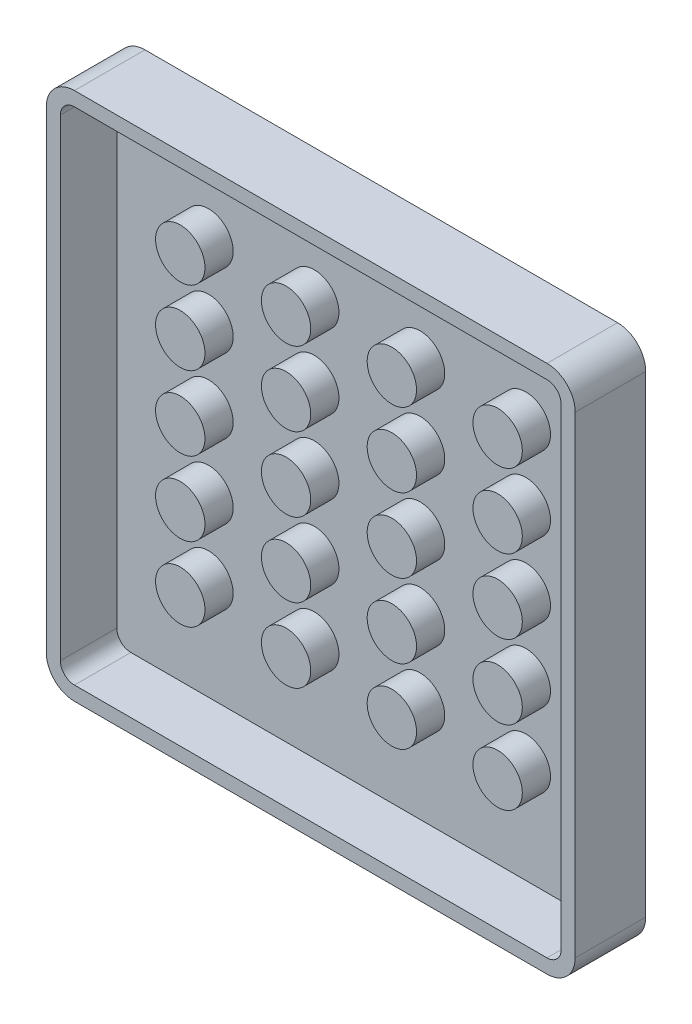
from build123d import *

# Parameters (mm, degrees)
SKETCH1_W           = 75
SKETCH1_H           = 75
BOSS_EXTRUDE1_DEPTH = 10
FILLET1_R           = 4
SHELL1_T            = -2
SKETCH2_R           = 3.5
BOSS_EXTRUDE2_DEPTH = 4


with BuildPart() as part:
    # Sketch1 → Boss-Extrude1 (new body)
    with BuildSketch(Plane.XY):
        with Locations((37.5, 37.5)):
            Rectangle(SKETCH1_W, SKETCH1_H)
    extrude(amount=BOSS_EXTRUDE1_DEPTH)

    # Fillet1
    fillet1_edges = [part.edges().sort_by_distance(p)[0] for p in [
        (0, 75, 5),
        (75, 75, 5),
        (75, 0, 5),
        (0, 0, 5),
    ]]
    fillet(fillet1_edges, radius=FILLET1_R)

    # Shell1
    shell1_openings = [part.faces().sort_by_distance(p)[0] for p in [
        (37.5, 37.5, 10),
    ]]
    offset(amount=SHELL1_T, openings=shell1_openings, kind=Kind.INTERSECTION)

    # Sketch2 → Boss-Extrude2 (add)
    with BuildSketch(Plane.XY.offset(2)):
        with Locations(Location((15, 58.5, 0), (0, 0, 180))):
            Circle(SKETCH2_R)
        with Locations(Location((30, 58.5, 0), (0, 0, 180))):
            Circle(SKETCH2_R)
        with Locations(Location((45, 58.5, 0), (0, 0, 180))):
            Circle(SKETCH2_R)
        with Locations(Location((60, 58.5, 0), (0, 0, 180))):
            Circle(SKETCH2_R)
        with Locations(Location((30, 48, 0), (0, 0, 180))):
            Circle(SKETCH2_R)
        with Locations(Location((45, 48, 0), (0, 0, 180))):
            Circle(SKETCH2_R)
        with Locations(Location((60, 48, 0), (0, 0, 180))):
            Circle(SKETCH2_R)
        with Locations(Location((30, 37.5, 0), (0, 0, 180))):
            Circle(SKETCH2_R)
        with Locations(Location((45, 37.5, 0), (0, 0, 180))):
            Circle(SKETCH2_R)
        with Locations(Location((60, 37.5, 0), (0, 0, 180))):
            Circle(SKETCH2_R)
        with Locations(Location((30, 27, 0), (0, 0, 180))):
            Circle(SKETCH2_R)
        with Locations(Location((45, 27, 0), (0, 0, 180))):
            Circle(SKETCH2_R)
        with Locations(Location((60, 27, 0), (0, 0, 180))):
            Circle(SKETCH2_R)
        with Locations(Location((30, 16.5, 0), (0, 0, 180))):
            Circle(SKETCH2_R)
        with Locations(Location((45, 16.5, 0), (0, 0, 180))):
            Circle(SKETCH2_R)
        with Locations(Location((60, 16.5, 0), (0, 0, 180))):
            Circle(SKETCH2_R)
        with Locations(Location((15, 48, 0), (0, 0, 180))):
            Circle(SKETCH2_R)
        with Locations(Location((15, 37.5, 0), (0, 0, 180))):
            Circle(SKETCH2_R)
        with Locations(Location((15, 27, 0), (0, 0, 180))):
            Circle(SKETCH2_R)
        with Locations(Location((15, 16.5, 0), (0, 0, 180))):
            Circle(SKETCH2_R)
    extrude(amount=BOSS_EXTRUDE2_DEPTH)


solid = part.part
